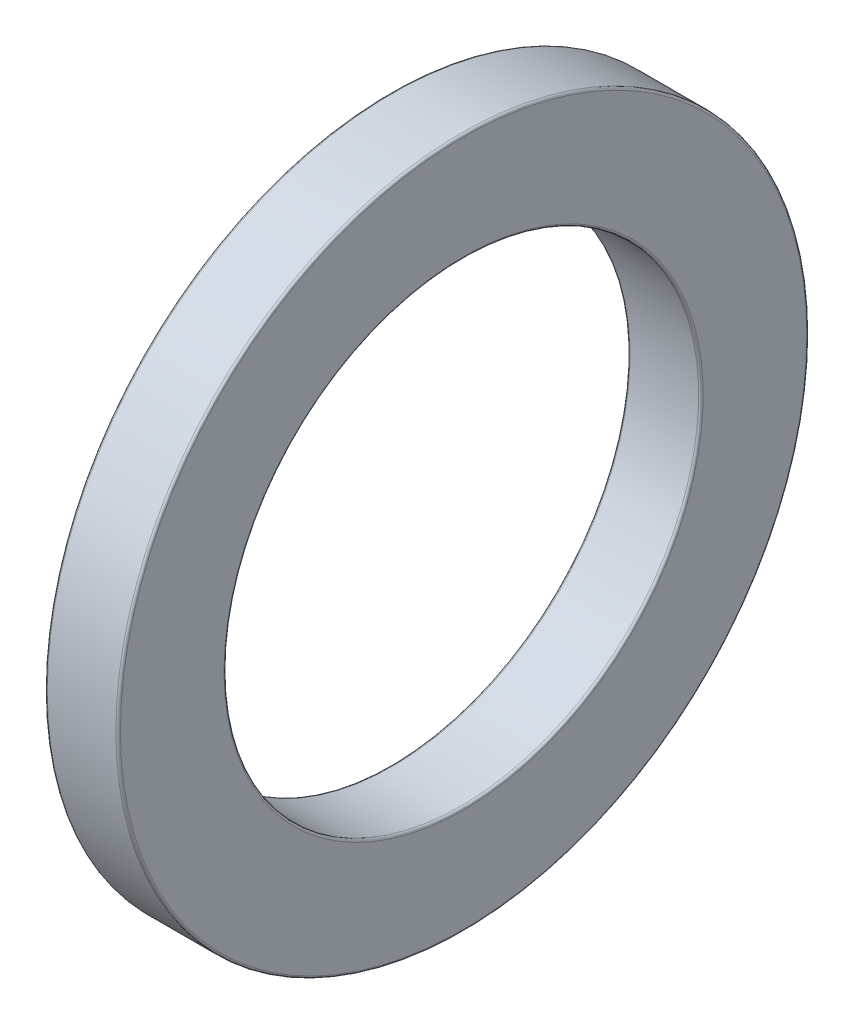
from build123d import *


with BuildPart() as part:
    # Croquis1 → Revolución1 (revolve)
    with BuildSketch(Plane(origin=(0, 0, 0), x_dir=(1, 0, 0), z_dir=(0, 1, 0)), mode=Mode.PRIVATE) as revoluci_n1_sk:
        with BuildLine():
            Line((0, 10.41), (1.505, 10.41))
            ThreePointArc((1.505, 10.41), (1.575710678, 10.439289322), (1.605, 10.51))
            Line((1.605, 10.51), (1.605, 15.05))
            ThreePointArc((1.605, 15.05), (1.575710678, 15.120710678), (1.505, 15.15))
            Line((1.505, 15.15), (-1.505, 15.15))
            ThreePointArc((-1.505, 15.15), (-1.575710678, 15.120710678), (-1.605, 15.05))
            Line((-1.605, 15.05), (-1.605, 10.51))
            ThreePointArc((-1.605, 10.51), (-1.575710678, 10.439289322), (-1.505, 10.41))
            Line((-1.505, 10.41), (0, 10.41))
        make_face()
    revolve(revoluci_n1_sk.sketch.rotate(Axis((0, 0, 0), (1, 0, 0)), 180), axis=Axis((0, 0, 0), (1, 0, 0)))


solid = part.part
